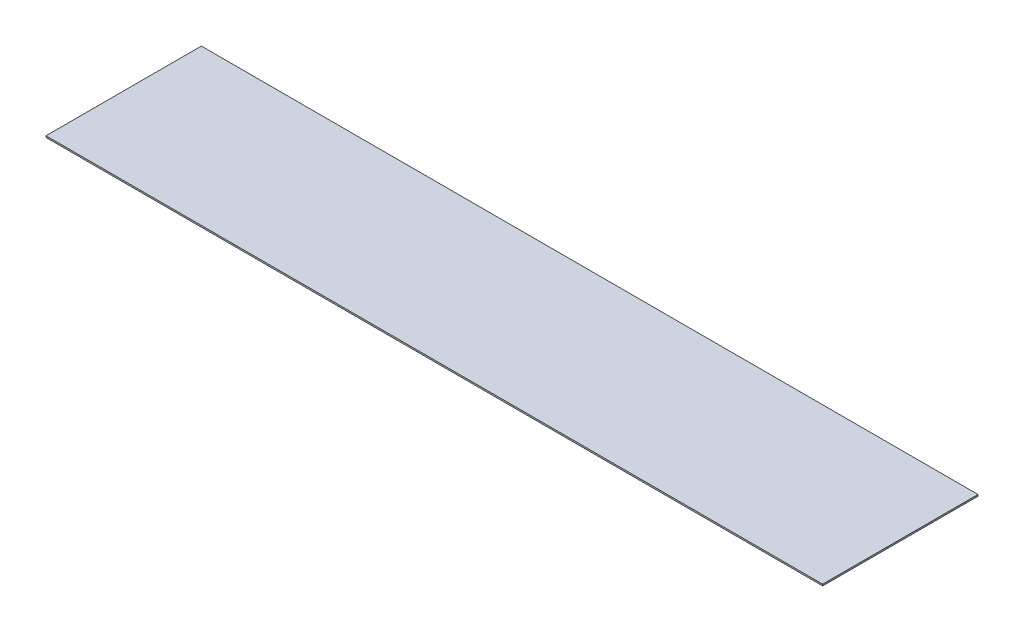
from build123d import *

# Parameters (mm, degrees)
ESQUISSE1_W        = 1270
ESQUISSE1_H        = 254
BOSS_EXTRU_1_DEPTH = 2.54


with BuildPart() as part:
    # Esquisse1 → Boss.-Extru.1 (new body)
    with BuildSketch(Plane(origin=(0, 0, 0), x_dir=(1, 0, 0), z_dir=(0, 1, 0))):
        Rectangle(ESQUISSE1_W, ESQUISSE1_H)
    extrude(amount=BOSS_EXTRU_1_DEPTH)


solid = part.part
